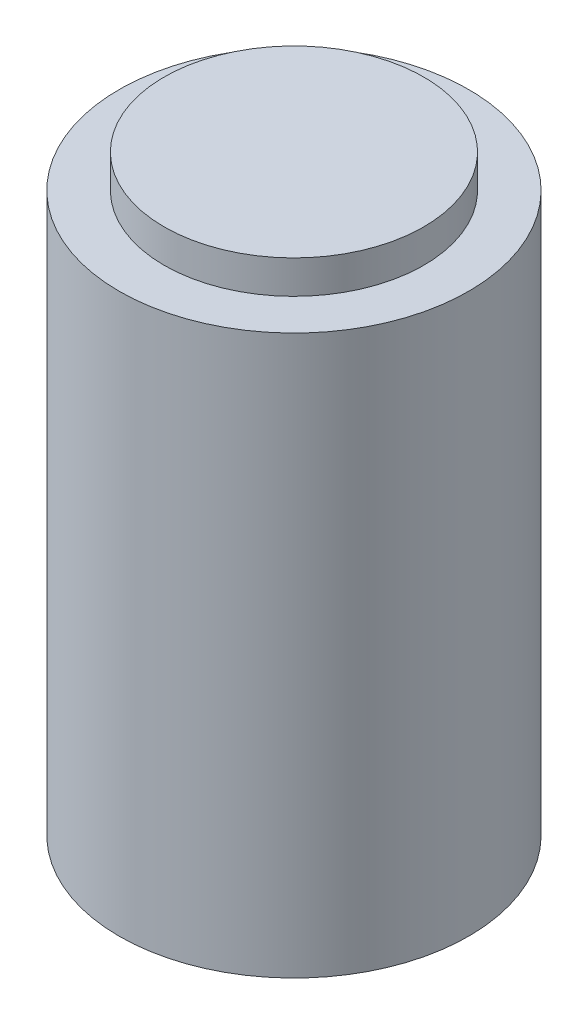
from build123d import *

# Parameters (mm, degrees)
SKETCH1_R           = 26.25
BOSS_EXTRUDE1_DEPTH = 83.9
SKETCH2_R           = 14.01
CUT_EXTRUDE1_DEPTH  = 75.9
SKETCH4_R           = 19.5
BOSS_EXTRUDE2_DEPTH = 5


with BuildPart() as part:
    # Sketch1 → Boss-Extrude1 (new body)
    with BuildSketch(Plane(origin=(0, 0, 0), x_dir=(1, 0, 0), z_dir=(0, 1, 0))):
        with Locations(Location((0, 0, 0), (0, 0, 270))):
            Circle(SKETCH1_R)
    extrude(amount=BOSS_EXTRUDE1_DEPTH)

    # Sketch2 → Cut-Extrude1 (cut)
    with BuildSketch(Plane.XZ):
        with Locations(Location((0, 0, 0), (0, 0, 270))):
            Circle(SKETCH2_R)
    extrude(amount=-CUT_EXTRUDE1_DEPTH, mode=Mode.SUBTRACT)

    # Sketch4 → Boss-Extrude2 (add)
    with BuildSketch(Plane(origin=(0, 83.9, 0), x_dir=(1, 0, 0), z_dir=(0, 1, 0))):
        with Locations(Location((0, 0, 0), (0, 0, 270))):
            Circle(SKETCH4_R)
    extrude(amount=BOSS_EXTRUDE2_DEPTH)


solid = part.part
